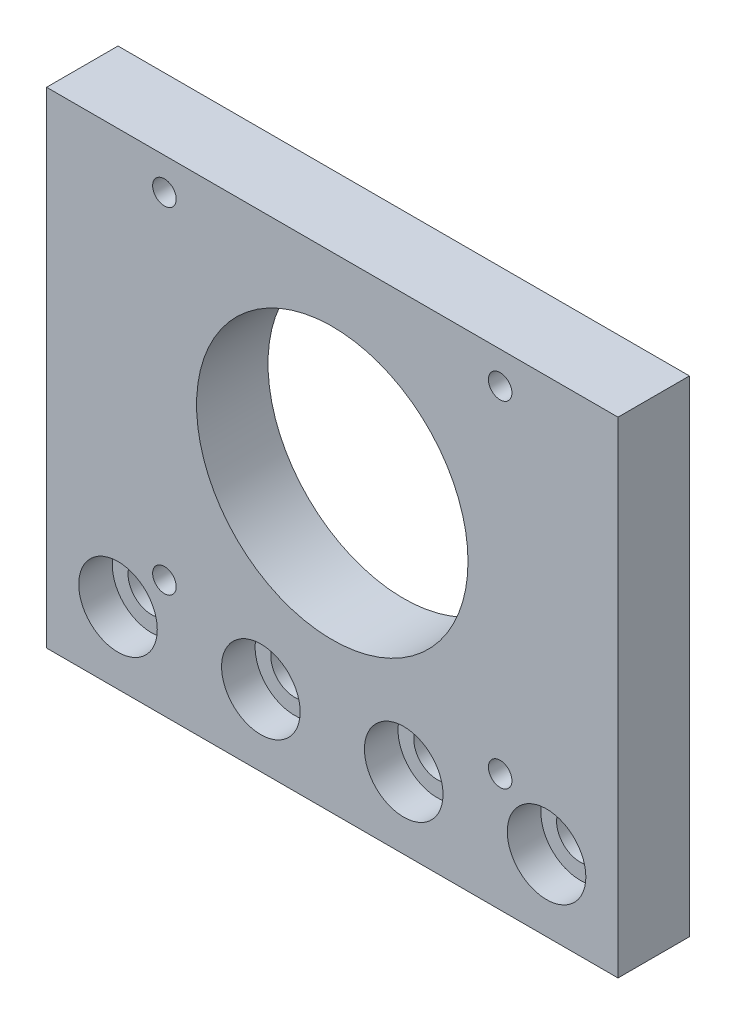
from build123d import *

# Parameters (mm, degrees)
SKETCH_1_W                   = 80
SKETCH_1_H                   = 68
EXTRUDE_1_DEPTH              = 10
SKETCH_2_R                   = 19
CUT_EXTRUDE_1_DEPTH          = 10
HOLE_WIZARD_M6_1_D           = 6.6
HOLE_WIZARD_M6_1_CBORE_D     = 11
HOLE_WIZARD_M6_1_CBORE_DEPTH = 4.7
HOLE_WIZARD_M4_1_D           = 3.3
SKETCH_7_R                   = 5
CUT_EXTRUDE_2_DEPTH          = 5


with BuildPart() as part:
    # 草图1 → 凸台-拉伸1 (new body)
    with BuildSketch(Plane.XY):
        with Locations((0, -6)):
            Rectangle(SKETCH_1_W, SKETCH_1_H)
    extrude(amount=-EXTRUDE_1_DEPTH)

    # 草图2 → 切除-拉伸1 (cut)
    with BuildSketch(Plane.XY):
        Circle(SKETCH_2_R)
    extrude(amount=-CUT_EXTRUDE_1_DEPTH, mode=Mode.SUBTRACT)

    # M6 内六角花型圆柱头螺钉的柱形沉头孔1 (through all)
    with Locations(Plane.XY):
        with Locations((30, -30), (-30, -30), (10, -30), (-10, -30)):
            CounterBoreHole(HOLE_WIZARD_M6_1_D / 2, HOLE_WIZARD_M6_1_CBORE_D / 2, HOLE_WIZARD_M6_1_CBORE_DEPTH)

    # M4 螺纹孔1 (through all)
    with Locations(Plane.XY):
        with Locations((23.5, -23.5), (0, 0), (23.5, 23.5), (-23.5, -23.5), (-23.5, 23.5)):
            Hole(HOLE_WIZARD_M4_1_D / 2)

    # 草图7 → 切除-拉伸2 (cut)
    with BuildSketch(Plane.XY.offset(-10)):
        with Locations((30, 0)):
            Circle(SKETCH_7_R)
    cut_extrude_2 = extrude(amount=CUT_EXTRUDE_2_DEPTH, mode=Mode.SUBTRACT)

    # 镜向1: 切除-拉伸2 across plane
    add(cut_extrude_2.mirror(Plane(origin=(0, 0, 0), x_dir=(0, 0, 1), z_dir=(1, 0, 0))), mode=Mode.SUBTRACT)


solid = part.part
